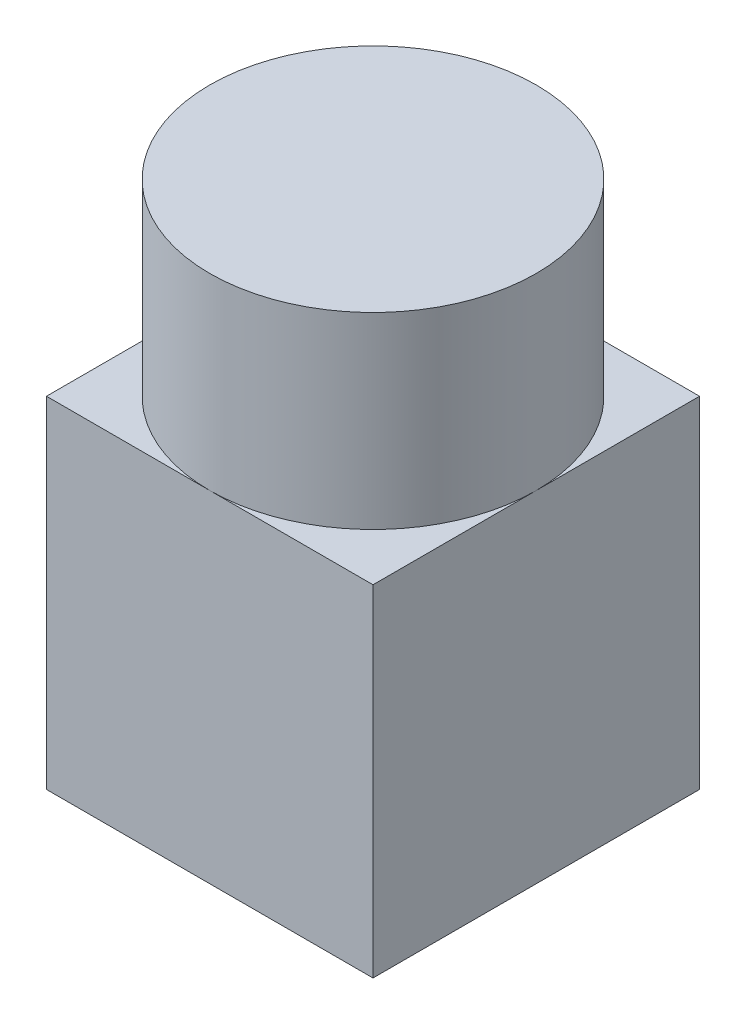
from build123d import *

# Parameters (mm, degrees)
SKETCH1_W           = 29.1
SKETCH1_H           = 29.1
BOSS_EXTRUDE1_DEPTH = 30.35
SKETCH2_R           = 14.55
BOSS_EXTRUDE2_DEPTH = 16.75


with BuildPart() as part:
    # Sketch1 → Boss-Extrude1 (new body)
    with BuildSketch(Plane(origin=(0, 0, 0), x_dir=(1, 0, 0), z_dir=(0, 1, 0))):
        Rectangle(SKETCH1_W, SKETCH1_H)
    extrude(amount=BOSS_EXTRUDE1_DEPTH)

    # Sketch2 → Boss-Extrude2 (add)
    with BuildSketch(Plane(origin=(0, 30.35, 0), x_dir=(1, 0, 0), z_dir=(0, 1, 0))):
        with Locations(Location((0, 0, 0), (0, 0, 270))):
            Circle(SKETCH2_R)
    extrude(amount=BOSS_EXTRUDE2_DEPTH)


solid = part.part
